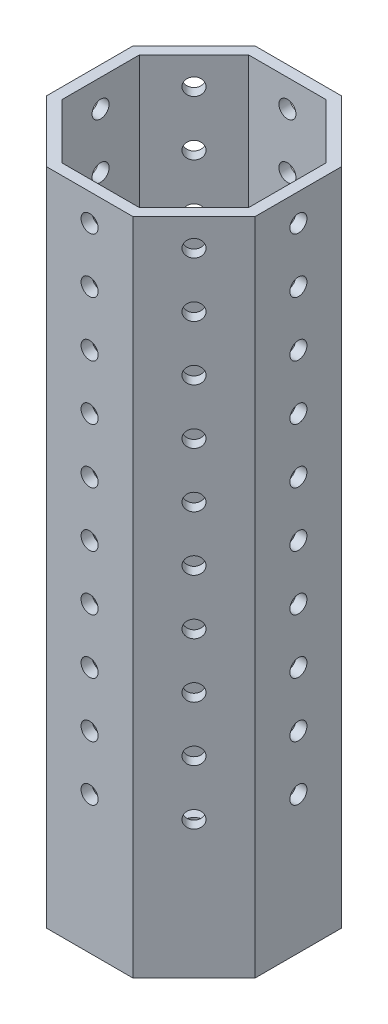
from build123d import *

# Parameters (mm, degrees)
CROQUIS1_R              = 1.55
CROQUIS1_R_2            = 4
SALIENTE_EXTRUIR1_DEPTH = 120
CORTAR_EXTRUIR1_DEPTH   = 117
CORTAR_EXTRUIR2_REACH   = 129.299
CROQUIS3_R              = 1.55
MATRIZC1_COUNT          = 8


with BuildPart() as part:
    # Croquis1 → Saliente-Extruir1 (new body)
    with BuildSketch(Plane(origin=(0, 0, 0), x_dir=(1, 0, 0), z_dir=(0, 1, 0))):
        Polygon((19, -7.870057685), (19, 7.870057685), (7.870057685, 19), (-7.870057685, 19), (-19, 7.870057685), (-19, -7.870057685), (-7.870057685, -19), (7.870057685, -19), align=None)
        with Locations(Location((0, 11, 0), (0, 0, 270))):
            Circle(CROQUIS1_R, mode=Mode.SUBTRACT)
        with Locations(Location((0, 0, 0), (0, 0, 270))):
            Circle(CROQUIS1_R_2, mode=Mode.SUBTRACT)
        with Locations(Location((7.778174593, 7.778174593, 0), (0, 0, 270))):
            Circle(CROQUIS1_R, mode=Mode.SUBTRACT)
        with Locations(Location((11, 0, 0), (0, 0, 270))):
            Circle(CROQUIS1_R, mode=Mode.SUBTRACT)
        with Locations(Location((7.778174593, -7.778174593, 0), (0, 0, 270))):
            Circle(CROQUIS1_R, mode=Mode.SUBTRACT)
        with Locations(Location((0, -11, 0), (0, 0, 270))):
            Circle(CROQUIS1_R, mode=Mode.SUBTRACT)
        with Locations(Location((-7.778174593, -7.778174593, 0), (0, 0, 270))):
            Circle(CROQUIS1_R, mode=Mode.SUBTRACT)
        with Locations(Location((-11, 0, 0), (0, 0, 270))):
            Circle(CROQUIS1_R, mode=Mode.SUBTRACT)
        with Locations(Location((-7.778174593, 7.778174593, 0), (0, 0, 270))):
            Circle(CROQUIS1_R, mode=Mode.SUBTRACT)
    extrude(amount=SALIENTE_EXTRUIR1_DEPTH)

    # Croquis2 → Cortar-Extruir1 (cut)
    with BuildSketch(Plane(origin=(0, 120, 0), x_dir=(1, 0, 0), z_dir=(0, 1, 0))):
        Polygon((7.04163056, 17), (-7.04163056, 17), (-17, 7.04163056), (-17, -7.04163056), (-7.04163056, -17), (7.04163056, -17), (17, -7.04163056), (17, 7.04163056), align=None)
    extrude(amount=-CORTAR_EXTRUIR1_DEPTH, mode=Mode.SUBTRACT)

    # Croquis3 → Cortar-Extruir2 (cut, up to next)
    with BuildSketch(Plane(origin=(0, 0, -19), x_dir=(-1, 0, 0), z_dir=(0, 0, -1)), mode=Mode.PRIVATE) as cortar_extruir2_sk1:
        with Locations((0, 115)):
            Circle(CROQUIS3_R)
    cortar_extruir2_tool1 = extrude(cortar_extruir2_sk1.sketch, amount=-CORTAR_EXTRUIR2_REACH, mode=Mode.PRIVATE) & part.part
    # Croquis3 → Cortar-Extruir2 (cut, up to next)
    with BuildSketch(Plane(origin=(0, 0, -19), x_dir=(-1, 0, 0), z_dir=(0, 0, -1)), mode=Mode.PRIVATE) as cortar_extruir2_sk2:
        with Locations((0, 105)):
            Circle(CROQUIS3_R)
    cortar_extruir2_tool2 = extrude(cortar_extruir2_sk2.sketch, amount=-CORTAR_EXTRUIR2_REACH, mode=Mode.PRIVATE) & part.part
    # Croquis3 → Cortar-Extruir2 (cut, up to next)
    with BuildSketch(Plane(origin=(0, 0, -19), x_dir=(-1, 0, 0), z_dir=(0, 0, -1)), mode=Mode.PRIVATE) as cortar_extruir2_sk3:
        with Locations((0, 95)):
            Circle(CROQUIS3_R)
    cortar_extruir2_tool3 = extrude(cortar_extruir2_sk3.sketch, amount=-CORTAR_EXTRUIR2_REACH, mode=Mode.PRIVATE) & part.part
    # Croquis3 → Cortar-Extruir2 (cut, up to next)
    with BuildSketch(Plane(origin=(0, 0, -19), x_dir=(-1, 0, 0), z_dir=(0, 0, -1)), mode=Mode.PRIVATE) as cortar_extruir2_sk4:
        with Locations((0, 85)):
            Circle(CROQUIS3_R)
    cortar_extruir2_tool4 = extrude(cortar_extruir2_sk4.sketch, amount=-CORTAR_EXTRUIR2_REACH, mode=Mode.PRIVATE) & part.part
    # Croquis3 → Cortar-Extruir2 (cut, up to next)
    with BuildSketch(Plane(origin=(0, 0, -19), x_dir=(-1, 0, 0), z_dir=(0, 0, -1)), mode=Mode.PRIVATE) as cortar_extruir2_sk5:
        with Locations((0, 75)):
            Circle(CROQUIS3_R)
    cortar_extruir2_tool5 = extrude(cortar_extruir2_sk5.sketch, amount=-CORTAR_EXTRUIR2_REACH, mode=Mode.PRIVATE) & part.part
    # Croquis3 → Cortar-Extruir2 (cut, up to next)
    with BuildSketch(Plane(origin=(0, 0, -19), x_dir=(-1, 0, 0), z_dir=(0, 0, -1)), mode=Mode.PRIVATE) as cortar_extruir2_sk6:
        with Locations((0, 65)):
            Circle(CROQUIS3_R)
    cortar_extruir2_tool6 = extrude(cortar_extruir2_sk6.sketch, amount=-CORTAR_EXTRUIR2_REACH, mode=Mode.PRIVATE) & part.part
    # Croquis3 → Cortar-Extruir2 (cut, up to next)
    with BuildSketch(Plane(origin=(0, 0, -19), x_dir=(-1, 0, 0), z_dir=(0, 0, -1)), mode=Mode.PRIVATE) as cortar_extruir2_sk7:
        with Locations((0, 55)):
            Circle(CROQUIS3_R)
    cortar_extruir2_tool7 = extrude(cortar_extruir2_sk7.sketch, amount=-CORTAR_EXTRUIR2_REACH, mode=Mode.PRIVATE) & part.part
    # Croquis3 → Cortar-Extruir2 (cut, up to next)
    with BuildSketch(Plane(origin=(0, 0, -19), x_dir=(-1, 0, 0), z_dir=(0, 0, -1)), mode=Mode.PRIVATE) as cortar_extruir2_sk8:
        with Locations((0, 45)):
            Circle(CROQUIS3_R)
    cortar_extruir2_tool8 = extrude(cortar_extruir2_sk8.sketch, amount=-CORTAR_EXTRUIR2_REACH, mode=Mode.PRIVATE) & part.part
    # Croquis3 → Cortar-Extruir2 (cut, up to next)
    with BuildSketch(Plane(origin=(0, 0, -19), x_dir=(-1, 0, 0), z_dir=(0, 0, -1)), mode=Mode.PRIVATE) as cortar_extruir2_sk9:
        with Locations((0, 35)):
            Circle(CROQUIS3_R)
    cortar_extruir2_tool9 = extrude(cortar_extruir2_sk9.sketch, amount=-CORTAR_EXTRUIR2_REACH, mode=Mode.PRIVATE) & part.part
    # Croquis3 → Cortar-Extruir2 (cut, up to next)
    with BuildSketch(Plane(origin=(0, 0, -19), x_dir=(-1, 0, 0), z_dir=(0, 0, -1)), mode=Mode.PRIVATE) as cortar_extruir2_sk10:
        with Locations((0, 25)):
            Circle(CROQUIS3_R)
    cortar_extruir2_tool10 = extrude(cortar_extruir2_sk10.sketch, amount=-CORTAR_EXTRUIR2_REACH, mode=Mode.PRIVATE) & part.part
    cortar_extruir2_1 = cortar_extruir2_tool1.solids().sort_by_distance((0, 115, -19))[0]
    add(cortar_extruir2_1, mode=Mode.SUBTRACT)
    cortar_extruir2_2 = cortar_extruir2_tool2.solids().sort_by_distance((0, 105, -19))[0]
    add(cortar_extruir2_2, mode=Mode.SUBTRACT)
    cortar_extruir2_3 = cortar_extruir2_tool3.solids().sort_by_distance((0, 95, -19))[0]
    add(cortar_extruir2_3, mode=Mode.SUBTRACT)
    cortar_extruir2_4 = cortar_extruir2_tool4.solids().sort_by_distance((0, 85, -19))[0]
    add(cortar_extruir2_4, mode=Mode.SUBTRACT)
    cortar_extruir2_5 = cortar_extruir2_tool5.solids().sort_by_distance((0, 75, -19))[0]
    add(cortar_extruir2_5, mode=Mode.SUBTRACT)
    cortar_extruir2_6 = cortar_extruir2_tool6.solids().sort_by_distance((0, 65, -19))[0]
    add(cortar_extruir2_6, mode=Mode.SUBTRACT)
    cortar_extruir2_7 = cortar_extruir2_tool7.solids().sort_by_distance((0, 55, -19))[0]
    add(cortar_extruir2_7, mode=Mode.SUBTRACT)
    cortar_extruir2_8 = cortar_extruir2_tool8.solids().sort_by_distance((0, 45, -19))[0]
    add(cortar_extruir2_8, mode=Mode.SUBTRACT)
    cortar_extruir2_9 = cortar_extruir2_tool9.solids().sort_by_distance((0, 35, -19))[0]
    add(cortar_extruir2_9, mode=Mode.SUBTRACT)
    cortar_extruir2_10 = cortar_extruir2_tool10.solids().sort_by_distance((0, 25, -19))[0]
    add(cortar_extruir2_10, mode=Mode.SUBTRACT)
    cortar_extruir2 = cortar_extruir2_1 + cortar_extruir2_2 + cortar_extruir2_3 + cortar_extruir2_4 + cortar_extruir2_5 + cortar_extruir2_6 + cortar_extruir2_7 + cortar_extruir2_8 + cortar_extruir2_9 + cortar_extruir2_10  # Cortar-Extruir2 as one shape, for the pattern or mirror that repeats it

    # MatrizC1: Cortar-Extruir2 ×8 about axis
    matrizc1_axis = Axis((0, 3, 0), (0, 1, 0))
    for i in range(1, MATRIZC1_COUNT):
        add(cortar_extruir2.rotate(matrizc1_axis, i * 360 / MATRIZC1_COUNT), mode=Mode.SUBTRACT)


solid = part.part
